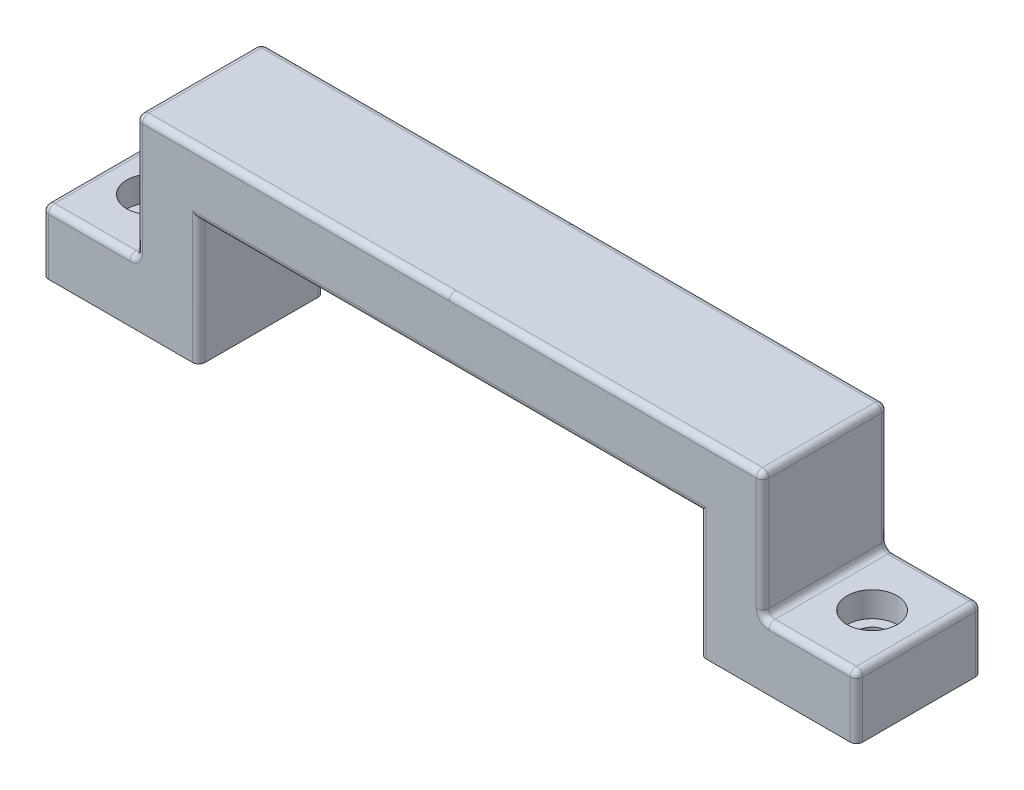
from build123d import *

# Parameters (mm, degrees)
BOSS_EXTRUDE1_DEPTH            = 20
CBORE_FOR_M4_SHCS1_D           = 4.7
CBORE_FOR_M4_SHCS1_CBORE_D     = 8
CBORE_FOR_M4_SHCS1_CBORE_DEPTH = 4
FILLET1_R                      = 1
FILLET1_OF_MIRROR1_R           = 1


with BuildPart() as part:
    # Sketch1 → Boss-Extrude1 (new body)
    with BuildSketch(Plane.XY):
        with BuildLine():
            Line((0, 0), (0, 9))
            ThreePointArc((0, 9), (0.292893219, 9.707106781), (1, 10))
            Line((1, 10), (14, 10))
            ThreePointArc((14, 10), (14.707106781, 10.292893219), (15, 11))
            Line((15, 11), (15, 29))
            ThreePointArc((15, 29), (15.292893219, 29.707106781), (16, 30))
            Line((16, 30), (65, 30))
            Line((65, 30), (65, 20))
            Line((65, 20), (25, 20))
            Line((25, 20), (25, 0))
            Line((25, 0), (0, 0))
        make_face()
    boss_extrude1 = extrude(amount=BOSS_EXTRUDE1_DEPTH)

    # CBORE for M4 SHCS1 (through all)
    with Locations(Plane(origin=(0, 10, 0), x_dir=(1, 0, 0), z_dir=(0, 1, 0))):
        with Locations((7.5, -10)):
            cbore_for_m4_shcs1 = CounterBoreHole(CBORE_FOR_M4_SHCS1_D / 2, CBORE_FOR_M4_SHCS1_CBORE_D / 2, CBORE_FOR_M4_SHCS1_CBORE_DEPTH)

    # Fillet1
    fillet1_edges = [part.edges().sort_by_distance(p)[0] for p in [
        (45, 20, 20),
        (0, 4.5, 0),
        (0.292893219, 9.707106781, 0),
        (7.5, 10, 0),
        (14.707106781, 10.292893219, 0),
        (15, 20, 0),
        (15.292893219, 29.707106781, 0),
        (40.5, 30, 0),
        (45, 20, 0),
        (25, 10, 0),
        (40.5, 30, 20),
        (15.292893219, 29.707106781, 20),
        (15, 20, 20),
        (14.707106781, 10.292893219, 20),
        (7.5, 10, 20),
        (0.292893219, 9.707106781, 20),
        (0, 4.5, 20),
        (25, 10, 20),
    ]]
    fillet(fillet1_edges, radius=FILLET1_R)

    # Mirror1: Boss-Extrude1, CBORE for M4 SHCS1 across plane
    add(boss_extrude1.mirror(Plane(origin=(65, 30, 20), x_dir=(0, 0, 1), z_dir=(-1, 0, 0))))
    add(cbore_for_m4_shcs1.mirror(Plane(origin=(65, 30, 20), x_dir=(0, 0, 1), z_dir=(-1, 0, 0))), mode=Mode.SUBTRACT)

    # Fillet1 of Mirror1
    fillet1_of_mirror1_edges = [part.edges().sort_by_distance(p)[0] for p in [
        (85, 20, 20),
        (130, 4.5, 0),
        (129.707106781, 9.707106781, 0),
        (122.5, 10, 0),
        (115.292893219, 10.292893219, 0),
        (115, 20, 0),
        (114.707106781, 29.707106781, 0),
        (89.5, 30, 0),
        (85, 20, 0),
        (105, 10, 0),
        (89.5, 30, 20),
        (114.707106781, 29.707106781, 20),
        (115, 20, 20),
        (115.292893219, 10.292893219, 20),
        (122.5, 10, 20),
        (129.707106781, 9.707106781, 20),
        (130, 4.5, 20),
        (105, 10, 20),
    ]]
    fillet(fillet1_of_mirror1_edges, radius=FILLET1_OF_MIRROR1_R)


solid = part.part
